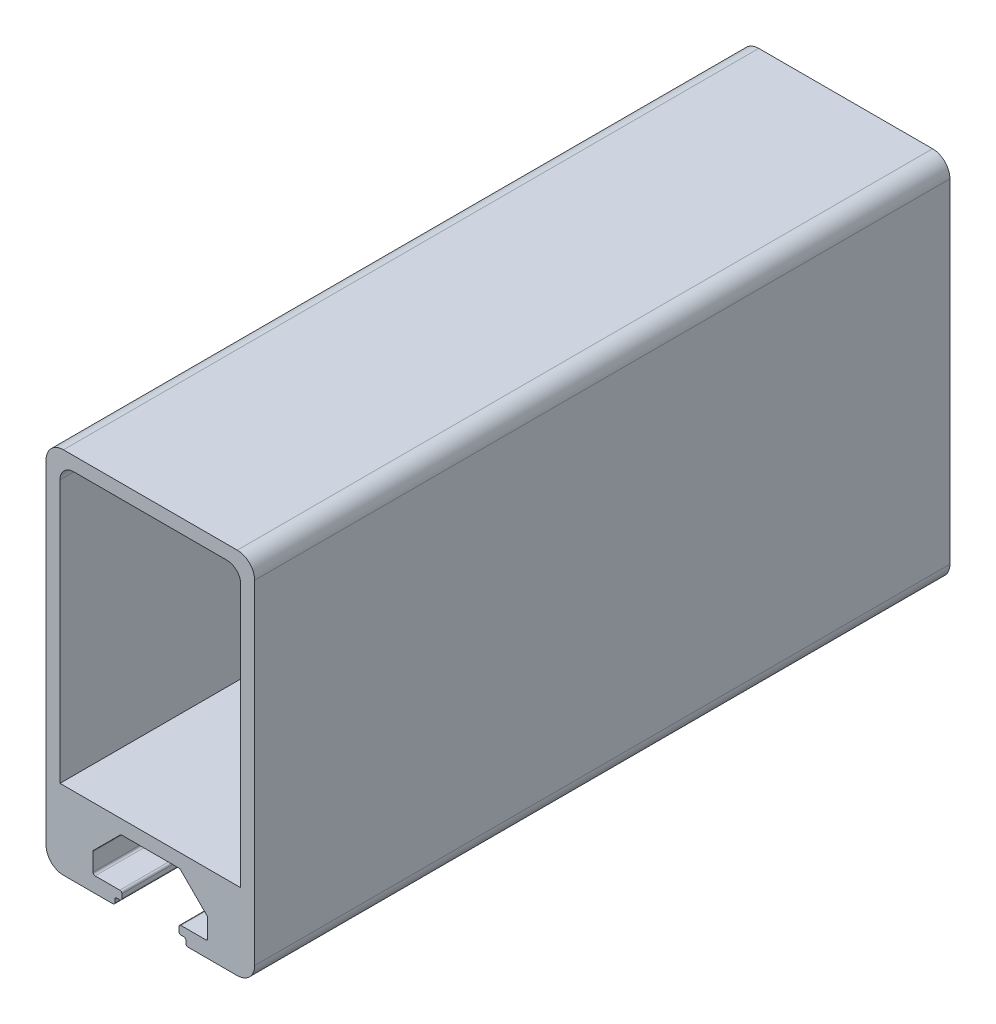
from build123d import *

# Parameters (mm, degrees)
EXTRUDE_1_DEPTH = 50


with BuildPart() as part:
    # 草图1 → 凸台-拉伸1 (new, symmetric)
    with BuildSketch(Plane.XY):
        with BuildLine():
            Line((12.49999999, 0), (-12.49999999, 0))
            ThreePointArc((-12.49999999, 0), (-14.267766942, -0.732233047), (-14.999999989, -2.499999998))
            Line((-14.999999989, -2.499999998), (-14.999999989, -50.500000002))
            ThreePointArc((-14.999999989, -50.500000002), (-14.267766942, -52.267766953), (-12.49999999, -53))
            Line((-12.49999999, -53), (-5.399999995, -53))
            ThreePointArc((-5.399999995, -53), (-5.187867961, -52.912132034), (-5.099999996, -52.7))
            Line((-5.099999996, -52.7), (-5.099999996, -52.300000001))
            ThreePointArc((-5.099999996, -52.300000001), (-5.01213203, -52.087867966), (-4.799999996, -52.000000001))
            Line((-4.799999996, -52.000000001), (-4.399999997, -52.000000001))
            ThreePointArc((-4.399999997, -52.000000001), (-4.187867962, -51.912132035), (-4.099999997, -51.700000001))
            Line((-4.099999997, -51.700000001), (-4.099999997, -51.100000001))
            ThreePointArc((-4.099999997, -51.100000001), (-4.187867962, -50.887867967), (-4.399999997, -50.800000002))
            Line((-4.399999997, -50.800000002), (-7.949999994, -50.800000002))
            ThreePointArc((-7.949999994, -50.800000002), (-8.162132028, -50.712132036), (-8.249999994, -50.500000002))
            Line((-8.249999994, -50.500000002), (-8.249999994, -47.929898991))
            ThreePointArc((-8.249999994, -47.929898991), (-8.227163853, -47.815093962), (-8.162132028, -47.717766957))
            Line((-8.162132028, -47.717766957), (-4.332233044, -43.887867973))
            ThreePointArc((-4.332233044, -43.887867973), (-4.234906039, -43.822836147), (-4.12010101, -43.800000007))
            Line((-4.12010101, -43.800000007), (4.12010101, -43.800000007))
            ThreePointArc((4.12010101, -43.800000007), (4.234906039, -43.822836147), (4.332233044, -43.887867973))
            Line((4.332233044, -43.887867973), (8.162132028, -47.717766957))
            ThreePointArc((8.162132028, -47.717766957), (8.227163854, -47.815093961), (8.249999994, -47.929898991))
            Line((8.249999994, -47.929898991), (8.249999994, -50.500000002))
            ThreePointArc((8.249999994, -50.500000002), (8.162132028, -50.712132036), (7.949999994, -50.800000002))
            Line((7.949999994, -50.800000002), (4.399999997, -50.800000002))
            ThreePointArc((4.399999997, -50.800000002), (4.187867963, -50.887867967), (4.099999997, -51.100000001))
            Line((4.099999997, -51.100000001), (4.099999997, -51.700000001))
            ThreePointArc((4.099999997, -51.700000001), (4.187867963, -51.912132035), (4.399999997, -52.000000001))
            Line((4.399999997, -52.000000001), (4.799999996, -52.000000001))
            ThreePointArc((4.799999996, -52.000000001), (5.01213203, -52.087867966), (5.099999996, -52.300000001))
            Line((5.099999996, -52.300000001), (5.099999996, -52.7))
            ThreePointArc((5.099999996, -52.7), (5.187867962, -52.912132034), (5.399999996, -53))
            Line((5.399999996, -53), (12.49999999, -53))
            ThreePointArc((12.49999999, -53), (14.267766942, -52.267766953), (14.999999989, -50.500000002))
            Line((14.999999989, -50.500000002), (14.999999989, -2.499999998))
            ThreePointArc((14.999999989, -2.499999998), (14.267766942, -0.732233047), (12.49999999, 0))
        make_face()
        with BuildLine():
            Line((10.999999989, -2), (-10.999999989, -2))
            ThreePointArc((-10.999999989, -2), (-12.414213551, -2.585786438), (-12.999999989, -4))
            Line((-12.999999989, -4), (-12.999999989, -41.800000007))
            Line((-12.999999989, -41.800000007), (12.999999989, -41.800000007))
            Line((12.999999989, -41.800000007), (12.999999989, -4))
            ThreePointArc((12.999999989, -4), (12.414213551, -2.585786438), (10.999999989, -2))
        make_face(mode=Mode.SUBTRACT)
    extrude(amount=EXTRUDE_1_DEPTH, both=True)


solid = part.part
